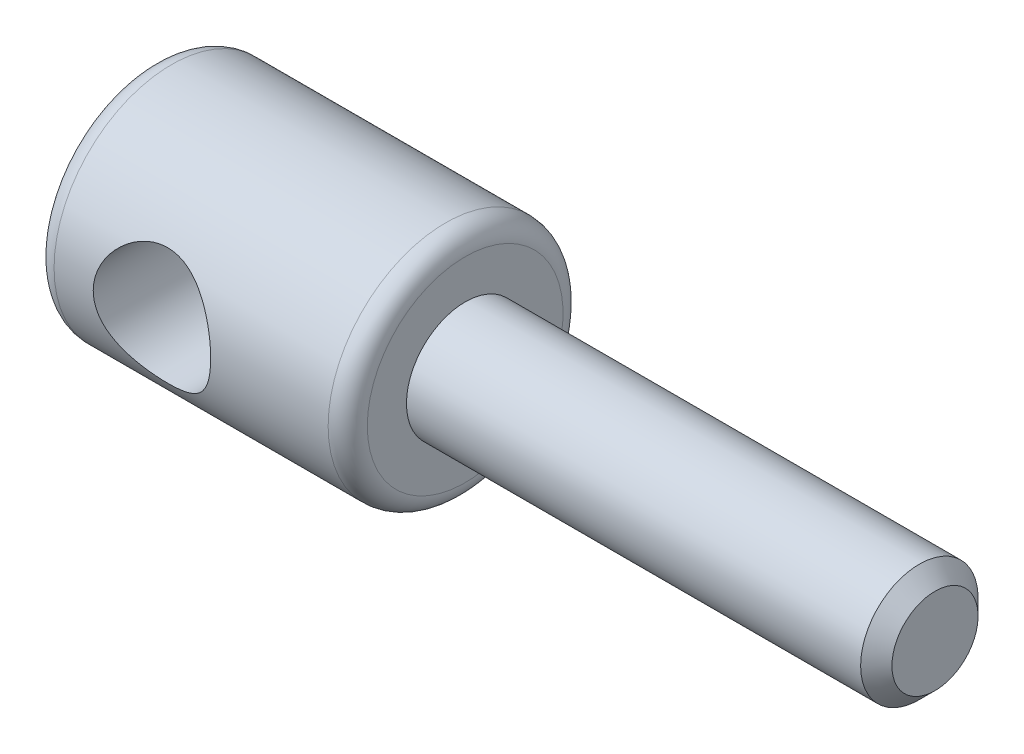
from build123d import *

# Parameters (mm, degrees)
FILLET1_R          = 1.5875
SKETCH2_R          = 4.7625
CUT_EXTRUDE2_DEPTH = 68.160068865
CHAMFER1_SIZE      = 1.27


with BuildPart() as part:
    # Sketch1 → Revolve1 (revolve)
    with BuildSketch(Plane.XY, mode=Mode.PRIVATE) as revolve1_sk:
        Polygon((0, 0), (0, 9.525), (25.4, 9.525), (25.4, 4.7625), (63.5, 4.7625), (63.5, 0), align=None)
    revolve(revolve1_sk.sketch.rotate(Axis((-10.444266115, 0, 0), (1, 0, 0)), 90), axis=Axis((-10.444266115, 0, 0), (1, 0, 0)))

    # Fillet1
    fillet1_edges = [part.edges().sort_by_distance(p)[0] for p in [
        (25.4, 0, -9.525),
        (0, 0, -9.525),
    ]]
    fillet(fillet1_edges, radius=FILLET1_R)

    # Sketch2 → Cut-Extrude2 (cut, through all)
    with BuildSketch(Plane.XY.offset(10.16)):
        with Locations((9.525, 0)):
            Circle(SKETCH2_R)
    extrude(amount=-CUT_EXTRUDE2_DEPTH, mode=Mode.SUBTRACT)

    # Chamfer1
    chamfer1_edges = [part.edges().sort_by_distance(p)[0] for p in [
        (63.5, 0, -4.7625),
    ]]
    chamfer(chamfer1_edges, length=CHAMFER1_SIZE)


solid = part.part
